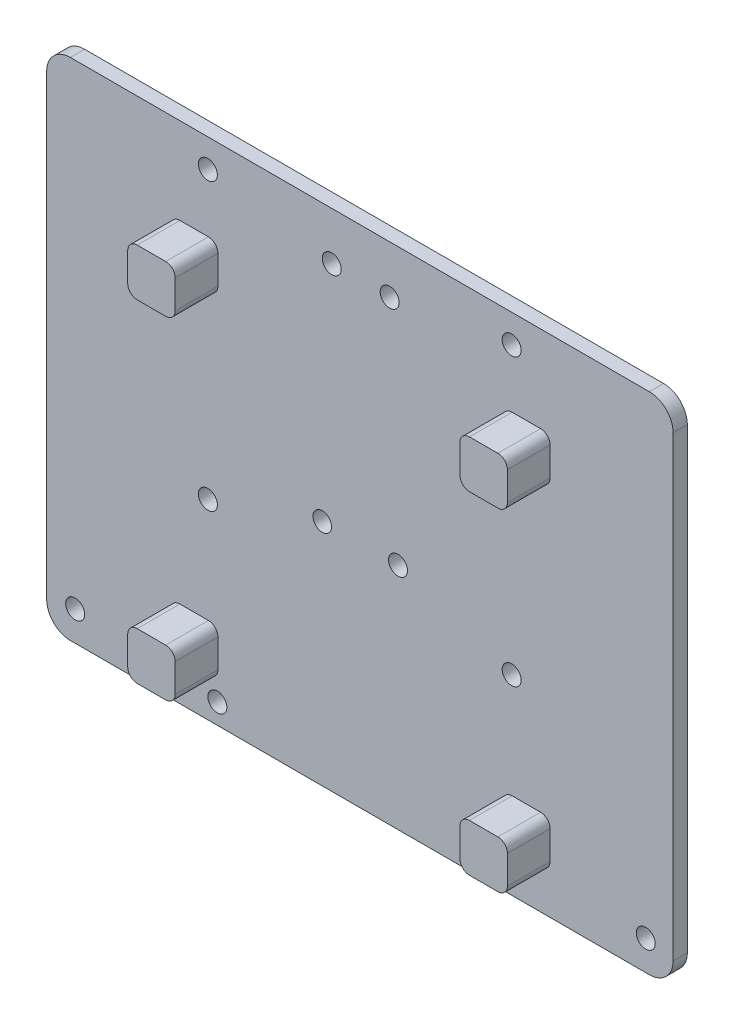
from build123d import *

# Parameters (mm, degrees)
SKETCH1_W           = 66
SKETCH1_H           = 53.2
SKETCH1_R           = 1
SKETCH1_R_2         = 0.98333
SKETCH1_R_3         = 1.011270727
BOSS_EXTRUDE1_DEPTH = 1.5
SKETCH2_W           = 5
SKETCH2_H           = 5
BOSS_EXTRUDE2_DEPTH = 4.5
FILLET1_R           = 1
FILLET2_R           = 2.5


with BuildPart() as part:
    # Sketch1 → Boss-Extrude1 (new body)
    with BuildSketch(Plane.XY.offset(10)):
        with Locations((177.963936399, 293.439054482)):
            Rectangle(SKETCH1_W, SKETCH1_H)
        with Locations((161.947495, 317.06050799)):
            Circle(SKETCH1_R, mode=Mode.SUBTRACT)
        with Locations((193.956452611, 317.06050799)):
            Circle(SKETCH1_R, mode=Mode.SUBTRACT)
        with Locations((174.997800233, 314.982847455)):
            Circle(SKETCH1_R, mode=Mode.SUBTRACT)
        with Locations((181.100928053, 314.982847455)):
            Circle(SKETCH1_R, mode=Mode.SUBTRACT)
        with Locations((173.997800233, 290.965333254)):
            Circle(SKETCH1_R_2, mode=Mode.SUBTRACT)
        with Locations((181.983306885, 290.965333254)):
            Circle(SKETCH1_R, mode=Mode.SUBTRACT)
        with Locations((161.947495, 286.962677261)):
            Circle(SKETCH1_R, mode=Mode.SUBTRACT)
        with Locations((193.956452611, 286.962677261)):
            Circle(SKETCH1_R, mode=Mode.SUBTRACT)
        with Locations((162.947495, 268.970540104)):
            Circle(SKETCH1_R, mode=Mode.SUBTRACT)
        with Locations((192.956452611, 268.970540104)):
            Circle(SKETCH1_R_3, mode=Mode.SUBTRACT)
        with Locations((208.084556857, 269.981810832)):
            Circle(SKETCH1_R, mode=Mode.SUBTRACT)
        with Locations((147.966567684, 269.970540104)):
            Circle(SKETCH1_R, mode=Mode.SUBTRACT)
    extrude(amount=BOSS_EXTRUDE1_DEPTH)

    # Sketch2 → Boss-Extrude2 (add)
    with BuildSketch(Plane.XY.offset(11.5)):
        with Locations((195.50417089, 308.439334712)):
            Rectangle(SKETCH2_W, SKETCH2_H)
        with Locations((160.50417089, 308.439334712)):
            Rectangle(SKETCH2_W, SKETCH2_H)
        with Locations((195.50417089, 273.439334712)):
            Rectangle(SKETCH2_W, SKETCH2_H)
        with Locations((160.50417089, 273.439334712)):
            Rectangle(SKETCH2_W, SKETCH2_H)
    extrude(amount=BOSS_EXTRUDE2_DEPTH)

    # Fillet1
    fillet1_edges = [part.edges().sort_by_distance(p)[0] for p in [
        (163.00417089, 275.939334712, 13.75),
        (158.00417089, 275.939334712, 13.75),
        (158.00417089, 270.939334712, 13.75),
        (163.00417089, 270.939334712, 13.75),
        (158.00417089, 310.939334712, 13.75),
        (158.00417089, 305.939334712, 13.75),
        (163.00417089, 305.939334712, 13.75),
        (163.00417089, 310.939334712, 13.75),
        (198.00417089, 310.939334712, 13.75),
        (193.00417089, 310.939334712, 13.75),
        (193.00417089, 305.939334712, 13.75),
        (198.00417089, 305.939334712, 13.75),
        (198.00417089, 275.939334712, 13.75),
        (193.00417089, 275.939334712, 13.75),
        (193.00417089, 270.939334712, 13.75),
        (198.00417089, 270.939334712, 13.75),
    ]]
    fillet(fillet1_edges, radius=FILLET1_R)

    # Fillet2
    fillet2_edges = [part.edges().sort_by_distance(p)[0] for p in [
        (144.963936399, 320.039054482, 10.75),
        (210.963936399, 320.039054482, 10.75),
        (210.963936399, 266.839054482, 10.75),
        (144.963936399, 266.839054482, 10.75),
    ]]
    fillet(fillet2_edges, radius=FILLET2_R)


solid = part.part
